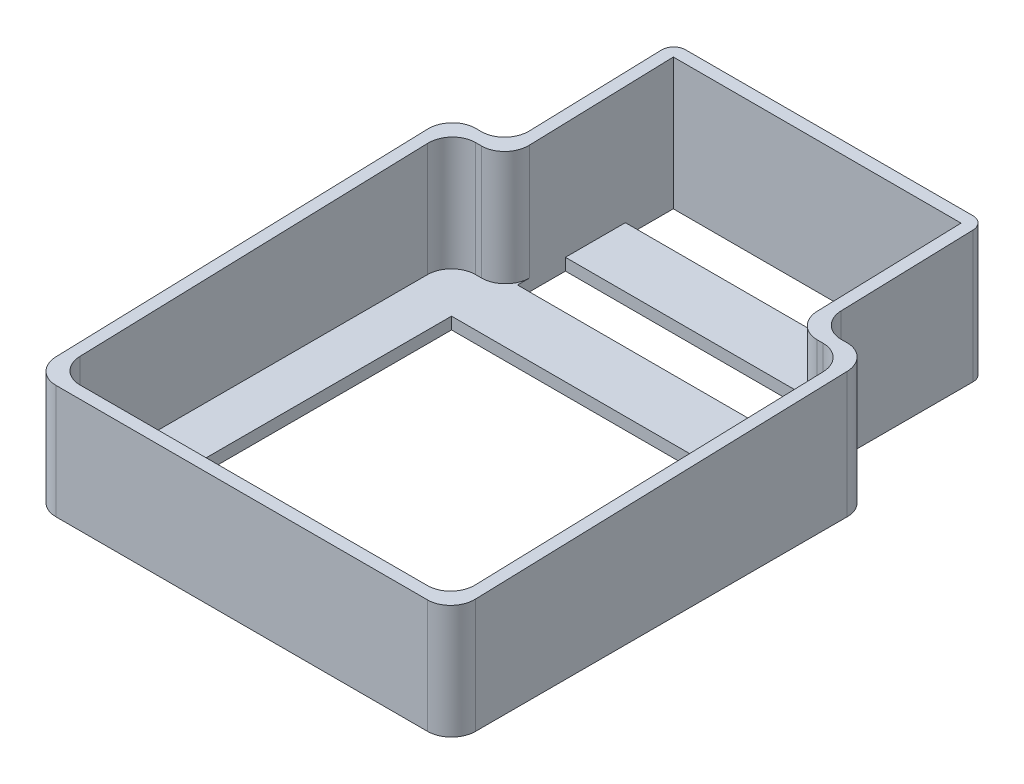
from build123d import *

# Parameters (mm, degrees)
SKETCH1_W               = 50
SKETCH1_H               = 50
SKETCH1_W_2             = 48
SKETCH1_H_2             = 8
BOSS_EXTRUDE1_DEPTH     = 2
FILLET1_R               = 4
FILLET2_R               = 2
BOSS_EXTRUDE2_START     = 20
BOSS_EXTRUDE2_DEPTH     = 20
CUT_EXTRUDE1_DEPTH      = 65.109281699
CUT_EXTRUDE1_DEPTH_BACK = 65.109281699


with BuildPart() as part:
    # Sketch1 → Boss-Extrude1 (new body)
    with BuildSketch(Plane(origin=(0, 0, 0), x_dir=(1, 0, 0), z_dir=(0, 1, 0))):
        Polygon((26, 49), (-26, 49), (-26, 21), (-35, 21), (-35, -49), (35, -49), (35, 21), (26, 21), align=None)
        with Locations((0, -14)):
            Rectangle(SKETCH1_W, SKETCH1_H, mode=Mode.SUBTRACT)
        with Locations((0, 25)):
            Rectangle(SKETCH1_W_2, SKETCH1_H_2, mode=Mode.SUBTRACT)
        with Locations((0, 43)):
            Rectangle(SKETCH1_W_2, SKETCH1_H_2, mode=Mode.SUBTRACT)
    extrude(amount=BOSS_EXTRUDE1_DEPTH)

    # Fillet1
    fillet1_edges = [part.edges().sort_by_distance(p)[0] for p in [
        (35, 1, -21),
        (35, 1, 49),
        (-35, 1, 49),
        (-35, 1, -21),
        (-26, 1, -21),
        (26, 1, -21),
    ]]
    fillet(fillet1_edges, radius=FILLET1_R)

    # Fillet2
    fillet2_edges = [part.edges().sort_by_distance(p)[0] for p in [
        (-26, 1, -49),
        (26, 1, -49),
    ]]
    fillet(fillet2_edges, radius=FILLET2_R)

    # Sketch4 → Boss-Extrude2 (add)
    with BuildSketch(Plane(origin=(0, 2, 0), x_dir=(1, 0, 0), z_dir=(0, 1, 0)).offset(BOSS_EXTRUDE2_START)):
        with BuildLine():
            Line((-31, -49), (31, -49))
            ThreePointArc((31, -49), (33.828427125, -47.828427125), (35, -45))
            Line((35, -45), (35, 17))
            ThreePointArc((35, 17), (33.828427125, 19.828427125), (31, 21))
            Line((31, 21), (30, 21))
            ThreePointArc((30, 21), (27.171572875, 22.171572875), (26, 25))
            Line((26, 25), (26, 47))
            ThreePointArc((26, 47), (25.414213562, 48.414213562), (24, 49))
            Line((24, 49), (-24, 49))
            ThreePointArc((-24, 49), (-25.414213562, 48.414213562), (-26, 47))
            Line((-26, 47), (-26, 25))
            ThreePointArc((-26, 25), (-27.171572875, 22.171572875), (-30, 21))
            Line((-30, 21), (-31, 21))
            ThreePointArc((-31, 21), (-33.828427125, 19.828427125), (-35, 17))
            Line((-35, 17), (-35, -45))
            ThreePointArc((-35, -45), (-33.828427125, -47.828427125), (-31, -49))
        make_face()
        with BuildLine():
            Line((-29, 19), (-28, 19))
            ThreePointArc((-28, 19), (-25.171572875, 20.171572875), (-24, 23))
            Line((-24, 23), (-24, 47))
            Line((-24, 47), (24, 47))
            Line((24, 47), (24, 23))
            ThreePointArc((24, 23), (25.171572875, 20.171572875), (28, 19))
            Line((28, 19), (29, 19))
            ThreePointArc((29, 19), (31.828427125, 17.828427125), (33, 15))
            Line((33, 15), (33, -43))
            ThreePointArc((33, -43), (31.828427125, -45.828427125), (29, -47))
            Line((29, -47), (-29, -47))
            ThreePointArc((-29, -47), (-31.828427125, -45.828427125), (-33, -43))
            Line((-33, -43), (-33, 15))
            ThreePointArc((-33, 15), (-31.828427125, 17.828427125), (-29, 19))
        make_face(mode=Mode.SUBTRACT)
    extrude(amount=-BOSS_EXTRUDE2_DEPTH)

    # Sketch6 → Cut-Extrude1 (cut, two sides: drawn at the far end of the back side and taken through both)
    with BuildSketch(Plane(origin=(0, 0, 0), x_dir=(0, 0, -1), z_dir=(1, 0, 0)).offset(-CUT_EXTRUDE1_DEPTH_BACK)):
        Polygon((-49, 22), (-49, 19), (49, 22), align=None)
    extrude(amount=CUT_EXTRUDE1_DEPTH + CUT_EXTRUDE1_DEPTH_BACK, mode=Mode.SUBTRACT)


solid = part.part
